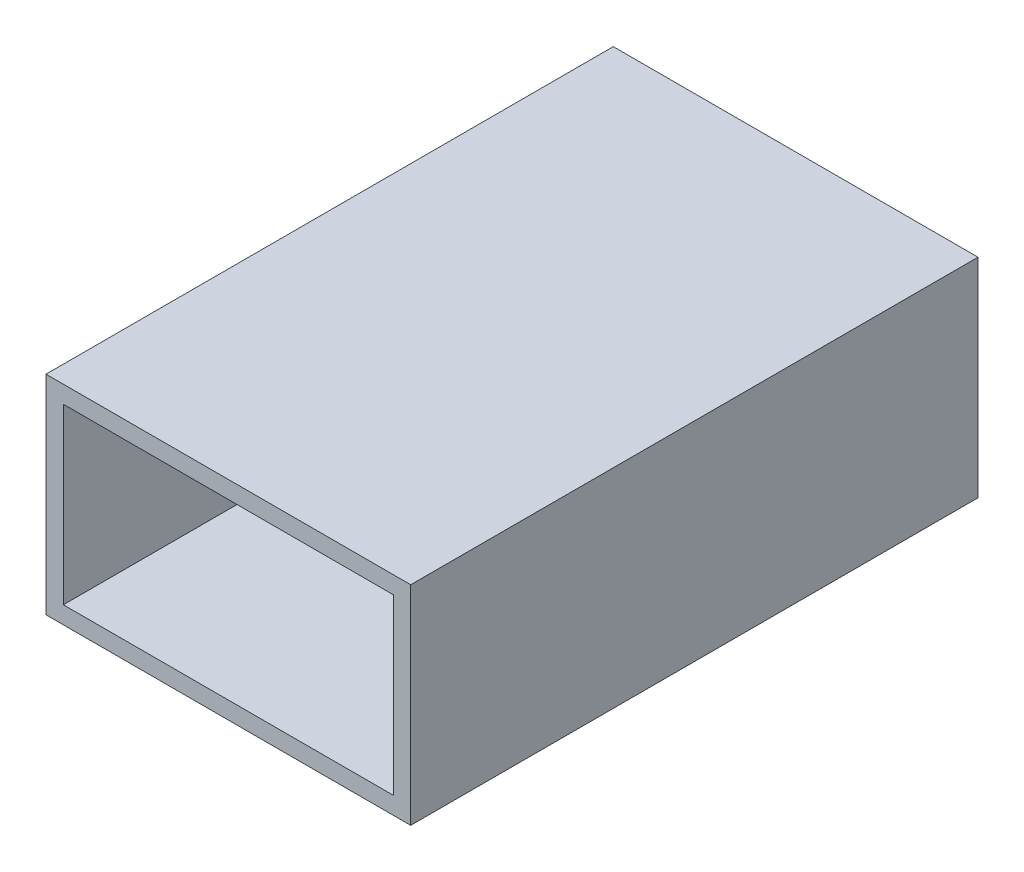
from build123d import *

# Parameters (mm, degrees)
SKETCH1_W           = 63
SKETCH1_H           = 36
SKETCH1_W_2         = 57
SKETCH1_H_2         = 30
BOSS_EXTRUDE1_DEPTH = 98
SKETCH2_W           = 57
SKETCH2_H           = 30
BOSS_EXTRUDE2_DEPTH = 3


with BuildPart() as part:
    # Sketch1 → Boss-Extrude1 (new body)
    with BuildSketch(Plane.XY):
        Rectangle(SKETCH1_W, SKETCH1_H)
        Rectangle(SKETCH1_W_2, SKETCH1_H_2, mode=Mode.SUBTRACT)
    extrude(amount=BOSS_EXTRUDE1_DEPTH)

    # Sketch2 → Boss-Extrude2 (add)
    with BuildSketch(Plane(origin=(0, 0, 0), x_dir=(-1, 0, 0), z_dir=(0, 0, -1))):
        Rectangle(SKETCH2_W, SKETCH2_H)
    extrude(amount=-BOSS_EXTRUDE2_DEPTH)


solid = part.part
